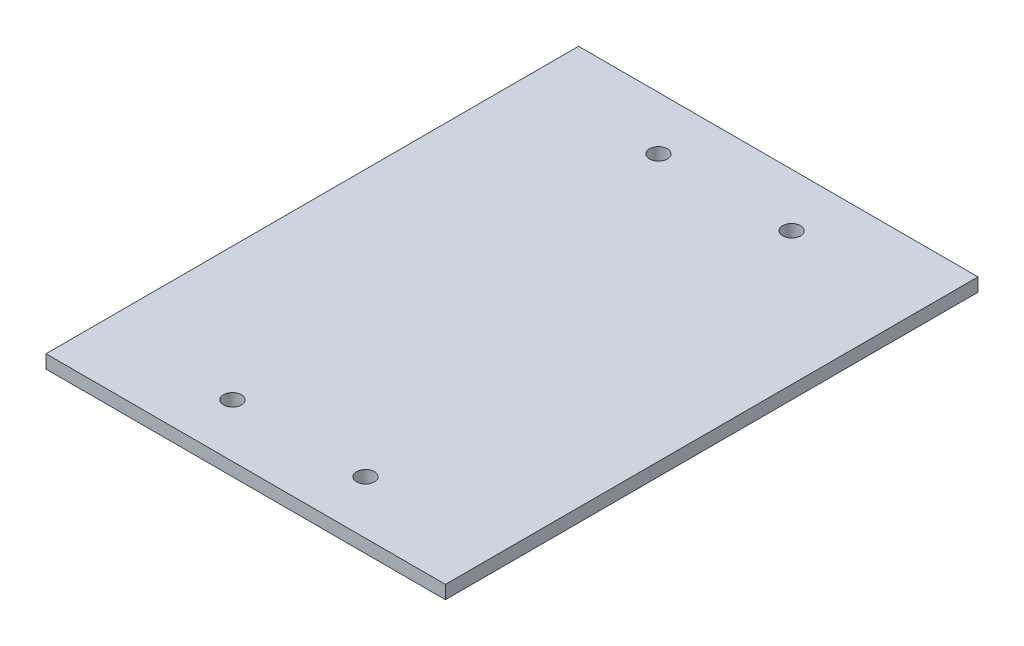
from build123d import *

# Parameters (mm, degrees)
SKETCH1_W           = 76.2
SKETCH1_H           = 101.6
SKETCH1_R           = 1.7
BOSS_EXTRUDE1_DEPTH = 2.54


with BuildPart() as part:
    # Sketch1 → Boss-Extrude1 (new body)
    with BuildSketch(Plane(origin=(0, 0, 0), x_dir=(1, 0, 0), z_dir=(0, 1, 0))):
        Rectangle(SKETCH1_W, SKETCH1_H)
        with Locations(Location((-12.7, 40.64, 0), (0, 0, 270))):
            Circle(SKETCH1_R, mode=Mode.SUBTRACT)
        with Locations(Location((12.7, 40.64, 0), (0, 0, 270))):
            Circle(SKETCH1_R, mode=Mode.SUBTRACT)
        with Locations(Location((12.7, -40.64, 0), (0, 0, 90))):
            Circle(SKETCH1_R, mode=Mode.SUBTRACT)
        with Locations(Location((-12.7, -40.64, 0), (0, 0, 90))):
            Circle(SKETCH1_R, mode=Mode.SUBTRACT)
    extrude(amount=BOSS_EXTRUDE1_DEPTH)


solid = part.part
